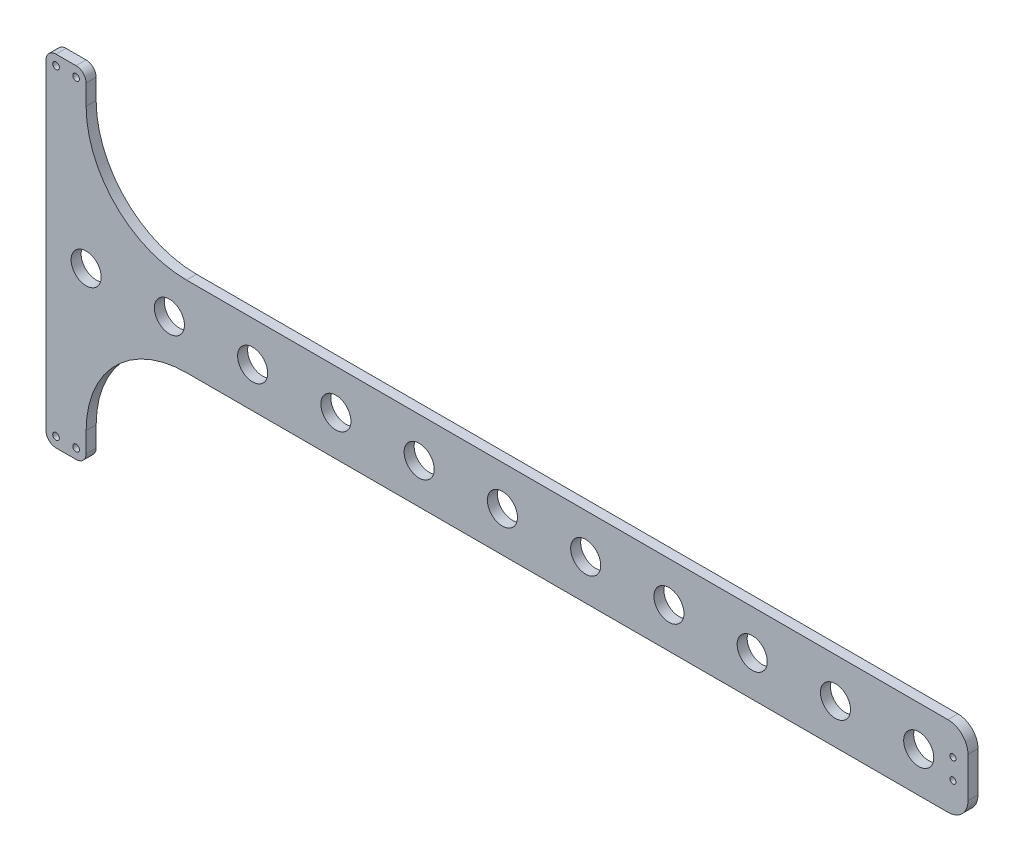
from build123d import *

# Parameters (mm, degrees)
SKETCH_1_W          = 439.55
SKETCH_1_H          = 20
SKETCH_1_W_2        = 20
SKETCH_1_H_2        = 170
SKETCH_1_R          = 1.65
EXTRUDE_1_DEPTH     = 5
FILLET_1_R          = 50
FILLET_2_R          = 5
SKETCH_2_R          = 1.5
CUT_EXTRUDE_1_DEPTH = 10
FILLET_3_R          = 10
SKETCH_3_R          = 7.5
CUT_EXTRUDE_2_DEPTH = 10


with BuildPart() as part:
    # ｽｹｯﾁ1 → ﾎﾞｽ - 押し出し1 (new body)
    # profile 1 of 3: a face of its own
    with BuildSketch(Plane.XY):
        with Locations((234.775, 10)):
            Rectangle(SKETCH_1_W, SKETCH_1_H)
    # profile 2 of 3: a face of its own
    with BuildSketch(Plane.XY):
        with Locations((234.775, -10)):
            Rectangle(SKETCH_1_W, SKETCH_1_H)
    # profile 3 of 3: a face of its own
    with BuildSketch(Plane.XY):
        with Locations((5, 0)):
            Rectangle(SKETCH_1_W_2, SKETCH_1_H_2)
        with Locations((10, -80)):
            Circle(SKETCH_1_R, mode=Mode.SUBTRACT)
        with Locations((10, 80)):
            Circle(SKETCH_1_R, mode=Mode.SUBTRACT)
        with Locations((0, 80)):
            Circle(SKETCH_1_R, mode=Mode.SUBTRACT)
        with Locations((0, -80)):
            Circle(SKETCH_1_R, mode=Mode.SUBTRACT)
    extrude(amount=EXTRUDE_1_DEPTH)

    # ﾌｨﾚｯﾄ1
    fillet_1_edges = [part.edges().sort_by_distance(p)[0] for p in [
        (15, 20, 2.5),
        (15, -20, 2.5),
    ]]
    fillet(fillet_1_edges, radius=FILLET_1_R)

    # ﾌｨﾚｯﾄ2
    fillet_2_edges = [part.edges().sort_by_distance(p)[0] for p in [
        (15, -85, 2.5),
        (-5, -85, 2.5),
        (-5, 85, 2.5),
        (15, 85, 2.5),
    ]]
    fillet(fillet_2_edges, radius=FILLET_2_R)

    # ｽｹｯﾁ2 → ｶｯﾄ - 押し出し1 (cut)
    with BuildSketch(Plane.XY.offset(5)):
        with Locations((447.05, 5)):
            Circle(SKETCH_2_R)
        with Locations((447.05, -5)):
            Circle(SKETCH_2_R)
    extrude(amount=-CUT_EXTRUDE_1_DEPTH, mode=Mode.SUBTRACT)

    # ﾌｨﾚｯﾄ3
    fillet_3_edges = [part.edges().sort_by_distance(p)[0] for p in [
        (454.55, 20, 2.5),
        (454.55, -20, 2.5),
    ]]
    fillet(fillet_3_edges, radius=FILLET_3_R)

    # ｽｹｯﾁ3 → ｶｯﾄ - 押し出し2 (cut)
    with BuildSketch(Plane.XY.offset(5)):
        with Locations((15, 0)):
            Circle(SKETCH_3_R)
        with Locations((56.5, 0)):
            Circle(SKETCH_3_R)
        with Locations((98, 0)):
            Circle(SKETCH_3_R)
        with Locations((139.5, 0)):
            Circle(SKETCH_3_R)
        with Locations((181, 0)):
            Circle(SKETCH_3_R)
        with Locations((222.5, 0)):
            Circle(SKETCH_3_R)
        with Locations((264, 0)):
            Circle(SKETCH_3_R)
        with Locations((305.5, 0)):
            Circle(SKETCH_3_R)
        with Locations((347, 0)):
            Circle(SKETCH_3_R)
        with Locations((388.5, 0)):
            Circle(SKETCH_3_R)
        with Locations((430, 0)):
            Circle(SKETCH_3_R)
    extrude(amount=-CUT_EXTRUDE_2_DEPTH, mode=Mode.SUBTRACT)


solid = part.part
